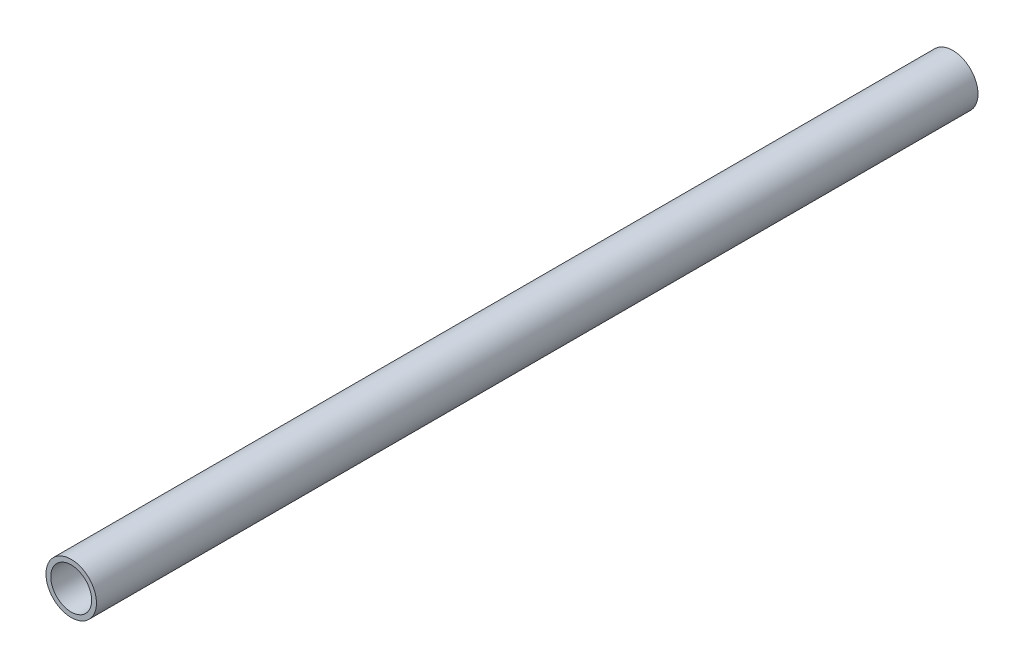
from build123d import *

# Parameters (mm, degrees)
SKETCH1_R           = 8.001
SKETCH1_R_2         = 6.477
BOSS_EXTRUDE1_DEPTH = 279.4


with BuildPart() as part:
    # Sketch1 → Boss-Extrude1 (new body)
    with BuildSketch(Plane.XY):
        Circle(SKETCH1_R)
        Circle(SKETCH1_R_2, mode=Mode.SUBTRACT)
    extrude(amount=-BOSS_EXTRUDE1_DEPTH)


solid = part.part
